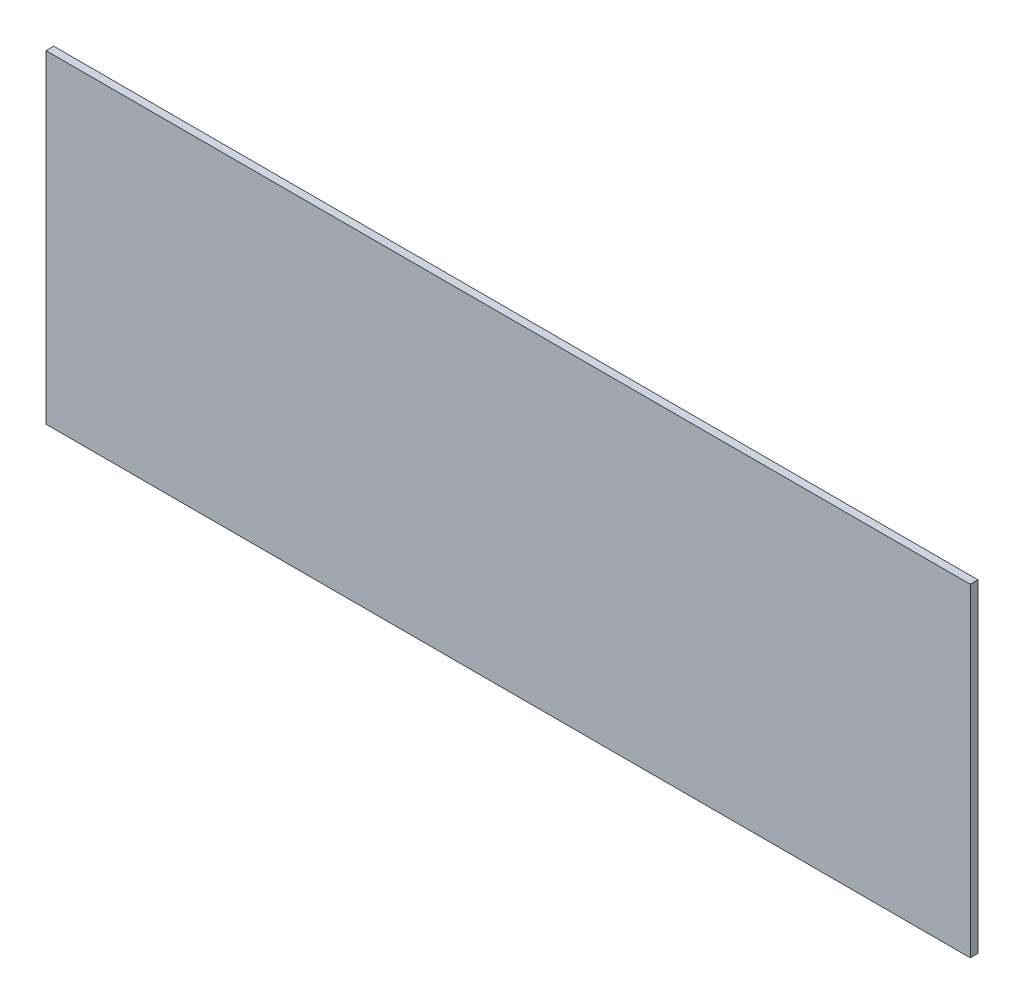
from build123d import *

# Parameters (mm, degrees)
SKETCH1_W           = 381
SKETCH1_H           = 133.35
BOSS_EXTRUDE1_DEPTH = 3.175


with BuildPart() as part:
    # Sketch1 → Boss-Extrude1 (new body)
    with BuildSketch(Plane.XY):
        Rectangle(SKETCH1_W, SKETCH1_H)
    extrude(amount=BOSS_EXTRUDE1_DEPTH)


solid = part.part
